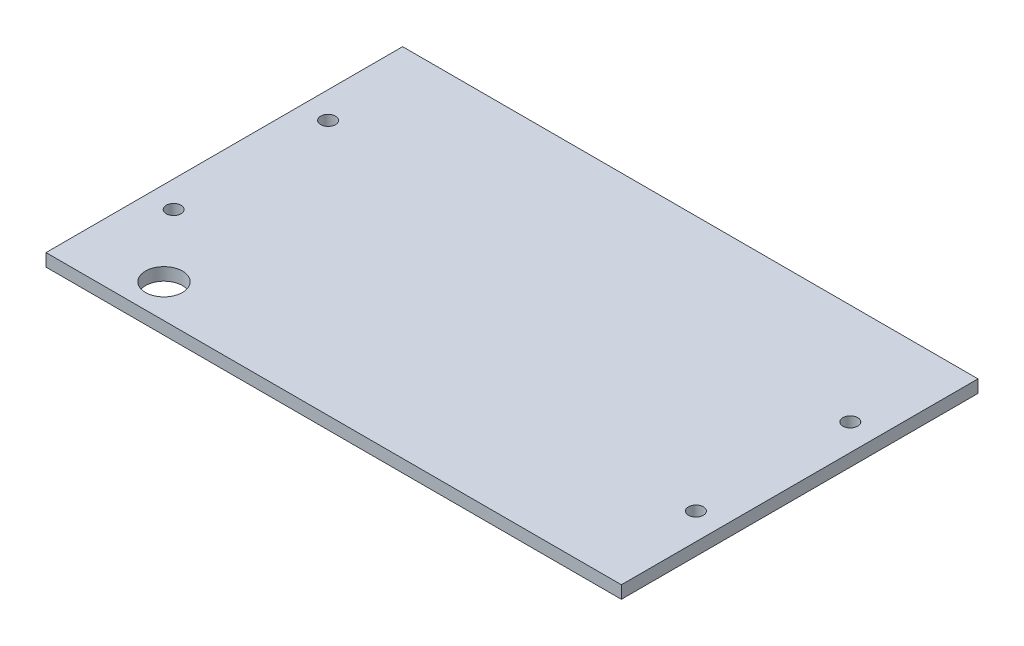
from build123d import *

# Parameters (mm, degrees)
SKETCH1_W           = 216.78392
SKETCH1_H           = 134.366
SKETCH1_R           = 6.985
SKETCH1_R_2         = 2.794
BOSS_EXTRUDE1_DEPTH = 4.7625


with BuildPart() as part:
    # Sketch1 → Boss-Extrude1 (new body)
    with BuildSketch(Plane(origin=(0, 0, 0), x_dir=(1, 0, 0), z_dir=(0, 1, 0))):
        with Locations((108.39196, 67.183)):
            Rectangle(SKETCH1_W, SKETCH1_H)
        with Locations(Location((31.75, 12.7, 0), (0, 0, 90))):
            Circle(SKETCH1_R, mode=Mode.SUBTRACT)
        with Locations(Location((10.0076, 96.266, 0), (0, 0, 90))):
            Circle(SKETCH1_R_2, mode=Mode.SUBTRACT)
        with Locations(Location((10.0076, 38.1, 0), (0, 0, 90))):
            Circle(SKETCH1_R_2, mode=Mode.SUBTRACT)
        with Locations(Location((206.77632, 96.266, 0), (0, 0, 90))):
            Circle(SKETCH1_R_2, mode=Mode.SUBTRACT)
        with Locations(Location((206.77632, 38.1, 0), (0, 0, 90))):
            Circle(SKETCH1_R_2, mode=Mode.SUBTRACT)
    extrude(amount=BOSS_EXTRUDE1_DEPTH)


solid = part.part
